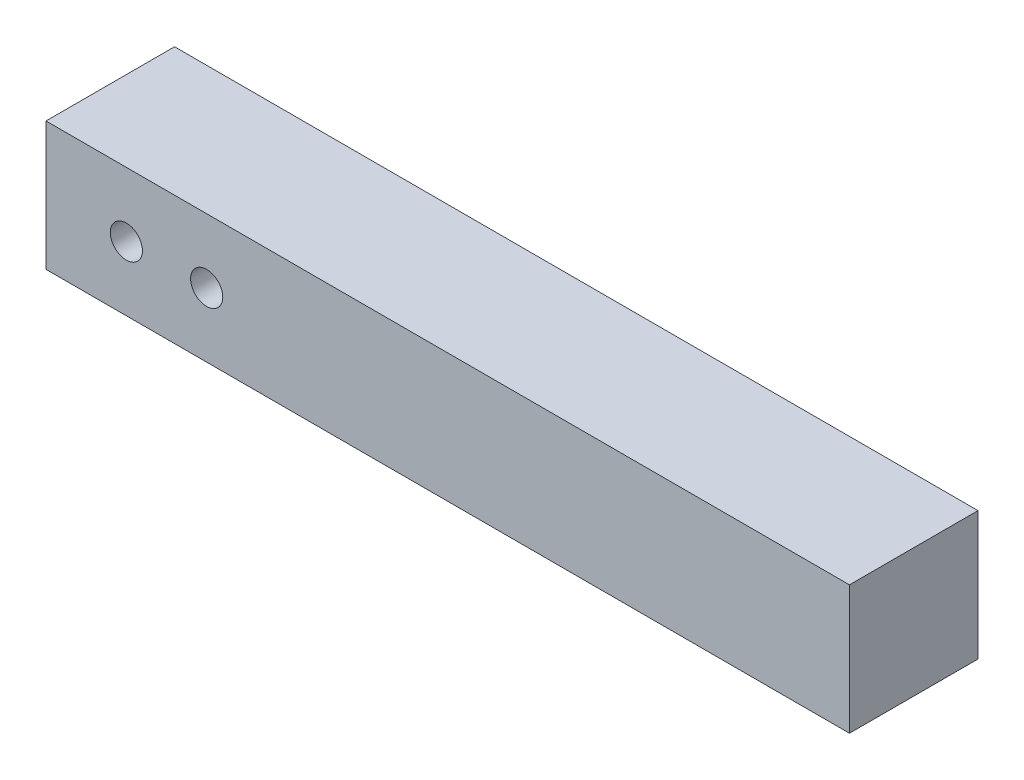
from build123d import *

# Parameters (mm, degrees)
SKETCH1_W           = 250
SKETCH1_H           = 40
SKETCH1_R           = 5
BOSS_EXTRUDE1_DEPTH = 40


with BuildPart() as part:
    # Sketch1 → Boss-Extrude1 (new body)
    with BuildSketch(Plane.XY):
        with Locations((125, -20)):
            Rectangle(SKETCH1_W, SKETCH1_H)
        with Locations((25, -20)):
            Circle(SKETCH1_R, mode=Mode.SUBTRACT)
        with Locations((50, -20)):
            Circle(SKETCH1_R, mode=Mode.SUBTRACT)
    extrude(amount=BOSS_EXTRUDE1_DEPTH)


solid = part.part
